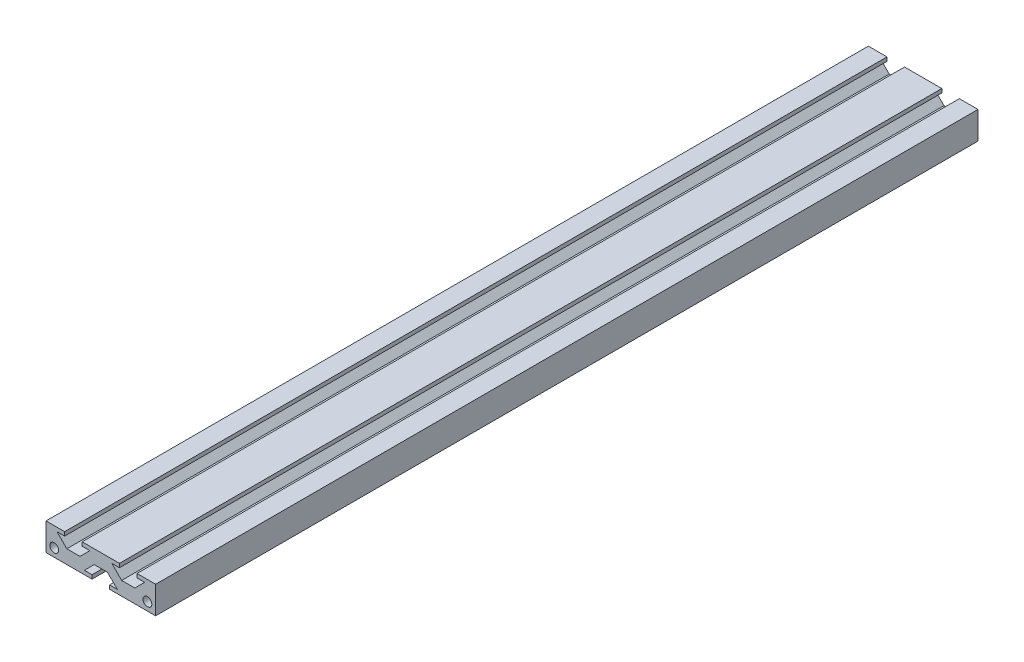
from build123d import *

# Parameters (mm, degrees)
SKETCH1_R           = 1.6
BOSS_EXTRUDE1_DEPTH = 300


with BuildPart() as part:
    # Sketch1 → Boss-Extrude1 (new body)
    with BuildSketch(Plane.XY):
        Polygon((-13.2, 5), (-13.2, 3.6), (-16, 3.6), (-12.4, 0), (-7.6, 0), (-4, 3.6), (-6.8, 3.6), (-6.8, 5), (6.8, 5), (6.8, 3.6), (4, 3.6), (7.6, 0), (12.4, 0), (16, 3.6), (13.2, 3.6), (13.2, 5), (20, 5), (20, -5), (3.2, -5), (3.2, -3.6), (6, -3.6), (2.4, 0), (-2.4, 0), (-6, -3.6), (-3.2, -3.6), (-3.2, -5), (-20, -5), (-20, 5), align=None)
        with Locations((-17, -2)):
            Circle(SKETCH1_R, mode=Mode.SUBTRACT)
        with Locations((17, -2)):
            Circle(SKETCH1_R, mode=Mode.SUBTRACT)
    extrude(amount=BOSS_EXTRUDE1_DEPTH)


solid = part.part
